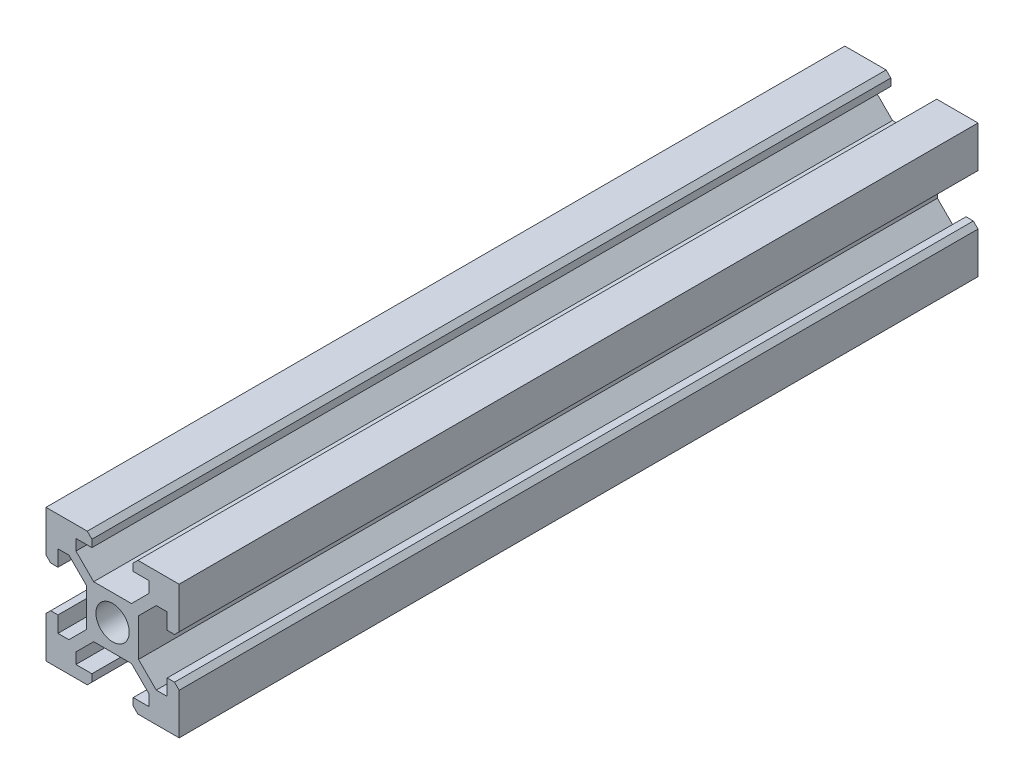
from build123d import *

# Parameters (mm, degrees)
SKETCH1_R           = 2.5
BOSS_EXTRUDE1_DEPTH = 60


with BuildPart() as part:
    # Sketch1 → Boss-Extrude1 (new, symmetric)
    with BuildSketch(Plane.XY):
        Polygon((3.9, -2.839339828), (6.560660172, -5.5), (8.200660172, -5.5), (8.200660172, -3.1), (9.3, -3.1), (10, -3.8), (10, -10), (3.8, -10), (3.1, -9.3), (3.1, -8.200660172), (5.5, -8.200660172), (5.5, -6.560660172), (2.839339828, -3.9), (-2.839339828, -3.9), (-5.5, -6.560660172), (-5.5, -8.200660172), (-3.1, -8.200660172), (-3.1, -9.3), (-3.8, -10), (-10, -10), (-10, -3.8), (-9.3, -3.1), (-8.200660172, -3.1), (-8.200660172, -5.5), (-6.560660172, -5.5), (-3.9, -2.839339828), (-3.9, 2.839339828), (-6.560660172, 5.5), (-8.200660172, 5.5), (-8.200660172, 3.1), (-9.3, 3.1), (-10, 3.8), (-10, 10), (-3.8, 10), (-3.1, 9.3), (-3.1, 8.200660172), (-5.5, 8.200660172), (-5.5, 6.560660172), (-2.839339828, 3.9), (2.839339828, 3.9), (5.5, 6.560660172), (5.5, 8.200660172), (3.1, 8.200660172), (3.1, 9.3), (3.8, 10), (10, 10), (10, 3.8), (9.3, 3.1), (8.200660172, 3.1), (8.200660172, 5.5), (6.560660172, 5.5), (3.9, 2.839339828), align=None)
        Circle(SKETCH1_R, mode=Mode.SUBTRACT)
    extrude(amount=BOSS_EXTRUDE1_DEPTH, both=True)


solid = part.part
